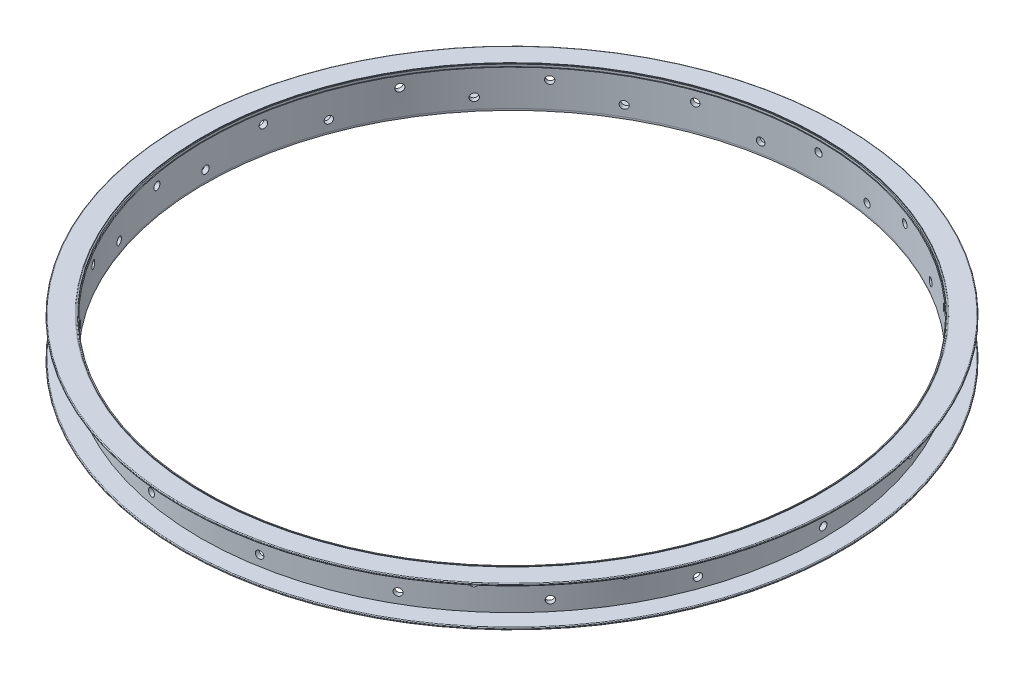
from build123d import *

# Parameters (mm, degrees)
CUT_EXTRUDE1_REACH      = 486.329
CUT_EXTRUDE1_END_RADIUS = 205.937329759
SKETCH3_R               = 2.5
CIRPATTERN1_COUNT       = 18
CUT_EXTRUDE2_REACH      = 486.329
CUT_EXTRUDE2_END_RADIUS = 205.937329759
SKETCH4_R               = 2.5
CIRPATTERN2_COUNT       = 18


with BuildPart() as part:
    # Sketch1 → Revolve2 (revolve)
    with BuildSketch(Plane(origin=(0, 0, 0), x_dir=(0, 0, -1), z_dir=(1, 0, 0))):
        with BuildLine():
            ThreePointArc((221.437329759, -13), (221.29088315, -13.353553391), (220.937329759, -13.5))
            Line((220.937329759, -13.5), (207.535204231, -13.5))
            Line((207.535204231, -13.5), (207.535204231, -13))
            Line((207.535204231, -13), (207.035204231, -13))
            Line((207.035204231, -13), (207.035204231, -13.5))
            Line((207.035204231, -13.5), (206.437329759, -13.5))
            Line((206.437329759, -13.5), (206.437329759, -12))
            Line((206.437329759, -12), (205.937329759, -12))
            Line((205.937329759, -12), (205.937329759, 12))
            Line((205.937329759, 12), (206.437329759, 12))
            Line((206.437329759, 12), (206.437329759, 13.5))
            Line((206.437329759, 13.5), (207.035204231, 13.5))
            Line((207.035204231, 13.5), (207.035204231, 13))
            Line((207.035204231, 13), (207.535204231, 13))
            Line((207.535204231, 13), (207.535204231, 13.5))
            Line((207.535204231, 13.5), (220.937329759, 13.5))
            ThreePointArc((220.937329759, 13.5), (221.29088315, 13.353553391), (221.437329759, 13))
            Line((221.437329759, 13), (221.437329759, 12.5))
            ThreePointArc((221.437329759, 12.5), (221.29088315, 12.146446609), (220.937329759, 12))
            Line((220.937329759, 12), (209.094560556, 12))
            Line((209.094560556, 12), (209.094560556, -12))
            Line((209.094560556, -12), (220.937329759, -12))
            ThreePointArc((220.937329759, -12), (221.29088315, -12.146446609), (221.437329759, -12.5))
            Line((221.437329759, -12.5), (221.437329759, -13))
        make_face()
    revolve(axis=Axis((0, 0, 0), (0, 1, 0)))

    # Cut-Extrude1: up to this cylinder (the profile starts outside it)
    cut_extrude1_end = Plane(origin=(0, 5, 0), z_dir=(0, -1, 0)) * Cylinder(CUT_EXTRUDE1_END_RADIUS, 1385.532659518, mode=Mode.PRIVATE)
    # Sketch3 → Cut-Extrude1 (cut, up to the surface)
    with BuildSketch(Plane.XY.offset(209.094560556), mode=Mode.PRIVATE) as cut_extrude1_sk1:
        with Locations((0, 5)):
            Circle(SKETCH3_R)
    cut_extrude1_tool1 = extrude(cut_extrude1_sk1.sketch, amount=-CUT_EXTRUDE1_REACH, mode=Mode.PRIVATE) - cut_extrude1_end
    cut_extrude1 = cut_extrude1_tool1.solids().sort_by_distance((0, 5, 209.094561))[0]
    add(cut_extrude1, mode=Mode.SUBTRACT)

    # CirPattern1: Cut-Extrude1 ×18 about axis
    cirpattern1_axis = Axis((0, 13.5, 0), (0, -1, 0))
    for i in range(1, CIRPATTERN1_COUNT):
        add(cut_extrude1.rotate(cirpattern1_axis, i * 360 / CIRPATTERN1_COUNT), mode=Mode.SUBTRACT)

    # Cut-Extrude2: up to this cylinder (the profile starts outside it)
    cut_extrude2_end = Plane(origin=(0, -5, 0), z_dir=(0, -1, 0)) * Cylinder(CUT_EXTRUDE2_END_RADIUS, 1385.532659518, mode=Mode.PRIVATE)
    # Sketch4 → Cut-Extrude2 (cut, up to the surface)
    with BuildSketch(Plane(origin=(209.094560556, 0, 0), x_dir=(0, 0, -1), z_dir=(1, 0, 0)), mode=Mode.PRIVATE) as cut_extrude2_sk1:
        with Locations((0, -5)):
            Circle(SKETCH4_R)
    cut_extrude2_tool1 = extrude(cut_extrude2_sk1.sketch, amount=-CUT_EXTRUDE2_REACH, mode=Mode.PRIVATE) - cut_extrude2_end
    cut_extrude2 = cut_extrude2_tool1.solids().sort_by_distance((209.094561, -5, 0))[0]
    add(cut_extrude2, mode=Mode.SUBTRACT)

    # CirPattern2: Cut-Extrude2 ×18 about axis
    cirpattern2_axis = Axis((0, 13.5, 0), (0, -1, 0))
    for i in range(1, CIRPATTERN2_COUNT):
        add(cut_extrude2.rotate(cirpattern2_axis, i * 360 / CIRPATTERN2_COUNT), mode=Mode.SUBTRACT)


solid = part.part
